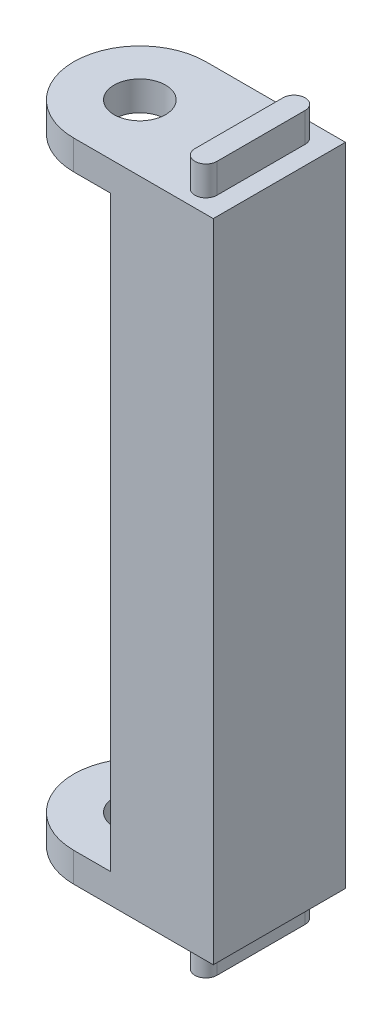
from build123d import *

# Parameters (mm, degrees)
SKETCH1_R           = 1.75
BOSS_EXTRUDE3_DEPTH = 2
BOSS_EXTRUDE4_DEPTH = 20
BOSS_EXTRUDE5_DEPTH = 4


with BuildPart() as part:
    # Sketch1 → Boss-Extrude3 (new body)
    with BuildSketch(Plane(origin=(0, 0, 0), x_dir=(1, 0, 0), z_dir=(0, 1, 0))):
        with BuildLine():
            ThreePointArc((-2.5, 4.5), (-7, 0), (-2.5, -4.5))
            Line((-2.5, -4.5), (7, -4.5))
            Line((7, -4.5), (7, 4.5))
            Line((7, 4.5), (-2.5, 4.5))
        make_face()
        with Locations((-2.5, 0)):
            Circle(SKETCH1_R, mode=Mode.SUBTRACT)
    extrude(amount=BOSS_EXTRUDE3_DEPTH)

    # Sketch1<3> → Boss-Extrude4 (add)
    # profile 1 of 2: a face of its own
    with BuildSketch(Plane(origin=(0, 0, 0), x_dir=(1, 0, 0), z_dir=(0, 1, 0))):
        with BuildLine():
            Line((2.508991915, 4.5), (0.004495957, 4.5))
            ThreePointArc((0.004495957, 4.5), (2.65, 0), (0.004495957, -4.5))
            Line((0.004495957, -4.5), (2.508991915, -4.5))
            Line((2.508991915, -4.5), (7, -4.5))
            Line((7, -4.5), (7, 4.5))
            Line((7, 4.5), (2.508991915, 4.5))
        make_face()
        with BuildLine():
            ThreePointArc((4.25, 3), (5, 3.75), (5.75, 3))
            Line((5.75, 3), (5.75, -3))
            ThreePointArc((5.75, -3), (5, -3.75), (4.25, -3))
            Line((4.25, -3), (4.25, 3))
        make_face(mode=Mode.SUBTRACT)
    # profile 2 of 2: a face of its own
    with BuildSketch(Plane(origin=(0, 0, 0), x_dir=(1, 0, 0), z_dir=(0, 1, 0))):
        with BuildLine():
            Line((4.25, 3), (4.25, -3))
            ThreePointArc((4.25, -3), (5, -3.75), (5.75, -3))
            Line((5.75, -3), (5.75, 3))
            ThreePointArc((5.75, 3), (5, 3.75), (4.25, 3))
        make_face()
    extrude(amount=-BOSS_EXTRUDE4_DEPTH)

    # Sketch1<5> → Boss-Extrude5 (add)
    with BuildSketch(Plane(origin=(0, 0, 0), x_dir=(1, 0, 0), z_dir=(0, 1, 0))):
        with BuildLine():
            Line((5.75, -3), (5.75, 3))
            ThreePointArc((5.75, 3), (5, 3.75), (4.25, 3))
            Line((4.25, 3), (4.25, -3))
            ThreePointArc((4.25, -3), (5, -3.75), (5.75, -3))
        make_face()
    extrude(amount=BOSS_EXTRUDE5_DEPTH)

    # Mirror1: part across plane


with BuildPart() as part_1:
    add(part.part)
    add(part.part.mirror(Plane.ZX.offset(-20)))


solid = part_1.part
